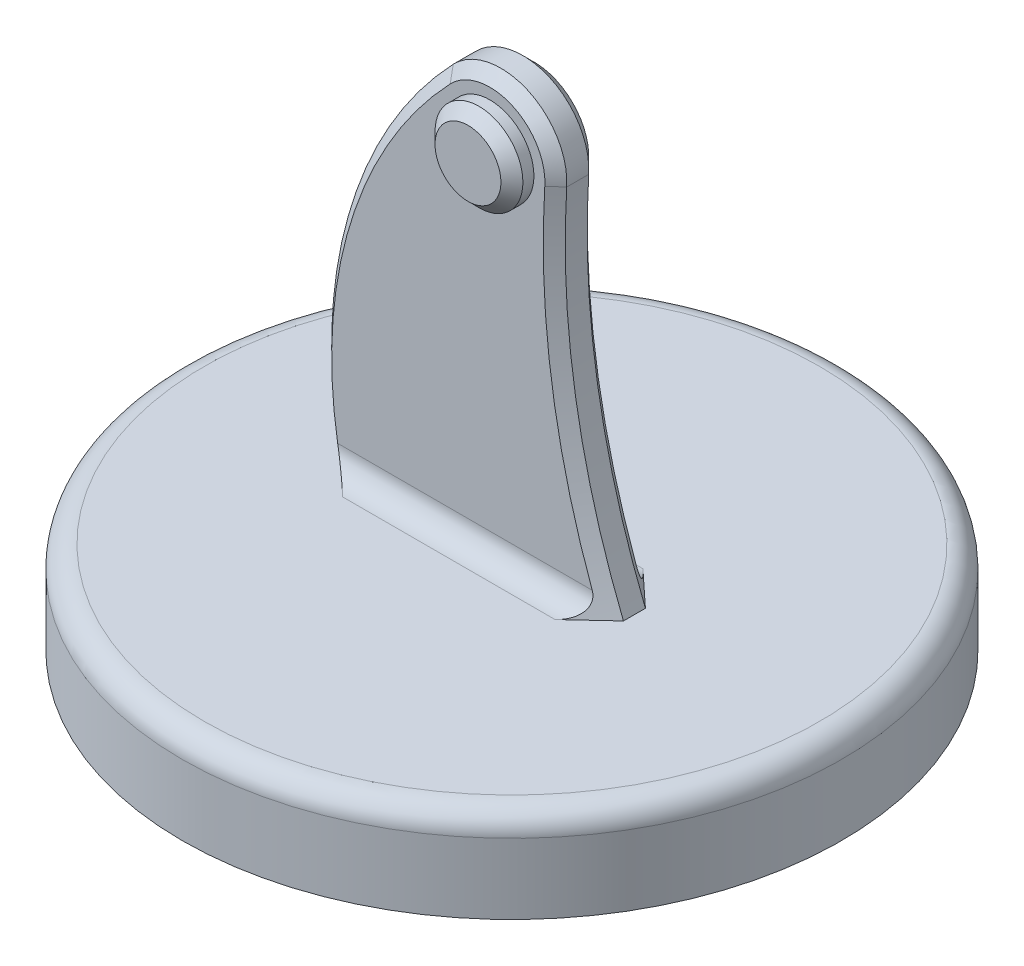
from build123d import *

# Parameters (mm, degrees)
BOSS_EXTRUDE1_DEPTH      = 20
BOSS_EXTRUDE1_DEPTH_BACK = 1
SKETCH1_R                = 75
FILLET1_R                = 5
BOSS_EXTRUDE2_DEPTH      = 5
CHAMFER1_SIZE            = 2.5
FILLET2_R                = 5
SKETCH4_R                = 10
BOSS_EXTRUDE3_DEPTH      = 5
CHAMFER2_SIZE            = 2.5
SKETCH5_R                = 5
CUT_EXTRUDE1_DEPTH       = 10


with BuildPart() as part:
    # Sketch1 → Boss-Extrude1 (new, two sides: drawn at the far end of the back side and taken through both)
    with BuildSketch(Plane(origin=(0, 0, 0), x_dir=(1, 0, 0), z_dir=(0, 1, 0)).offset(-BOSS_EXTRUDE1_DEPTH_BACK)):
        with Locations(Location((0, 0, 0), (0, 0, 270))):
            Circle(SKETCH1_R)
    extrude(amount=BOSS_EXTRUDE1_DEPTH + BOSS_EXTRUDE1_DEPTH_BACK)

    # Fillet1
    fillet1_edges = [part.edges().sort_by_distance(p)[0] for p in [
        (0, 20, -75),
    ]]
    fillet(fillet1_edges, radius=FILLET1_R)

    # Sketch3 → Boss-Extrude2 (add, symmetric)
    with BuildSketch(Plane.XY):
        with BuildLine():
            Line((-35, 15), (30, 15))
            ThreePointArc((30, 15), (17.428098582, 56.126843631), (14.970645506, 99.06203778))
            ThreePointArc((14.970645506, 99.06203778), (6.012327577, 113.742340307), (-10.849201429, 110.358321696))
            ThreePointArc((-10.849201429, 110.358321696), (-35.460543036, 65.854059614), (-35, 15))
        make_face()
    extrude(amount=BOSS_EXTRUDE2_DEPTH, both=True)

    # Chamfer1
    chamfer1_edges = [part.edges().sort_by_distance(p)[0] for p in [
        (-34.796467261, 68.341174934, -5),
        (16.970295051, 58.803839559, -5),
        (6.012327577, 113.742340307, -5),
        (16.970295051, 58.803839559, 5),
        (6.012327577, 113.742340307, 5),
        (-34.796467261, 68.341174934, 5),
    ]]
    chamfer(chamfer1_edges, length=CHAMFER1_SIZE)

    # Fillet2
    fillet2_edges = [part.edges().sort_by_distance(p)[0] for p in [
        (-4.241511046, 20, -5),
        (-4.241511046, 20, 5),
    ]]
    fillet(fillet2_edges, radius=FILLET2_R)

    # Sketch4 → Boss-Extrude3 (add)
    with BuildSketch(Plane.XY.offset(5)):
        with Locations(Location((0, 100, 0), (0, 0, 180))):
            Circle(SKETCH4_R)
    extrude(amount=BOSS_EXTRUDE3_DEPTH)

    # Chamfer2
    chamfer2_edges = [part.edges().sort_by_distance(p)[0] for p in [
        (10, 100, 10),
    ]]
    chamfer(chamfer2_edges, length=CHAMFER2_SIZE)

    # Sketch5 → Cut-Extrude1 (cut)
    with BuildSketch(Plane(origin=(0, 0, -5), x_dir=(-1, 0, 0), z_dir=(0, 0, -1))):
        with Locations((0, 100)):
            Circle(SKETCH5_R)
    extrude(amount=-CUT_EXTRUDE1_DEPTH, mode=Mode.SUBTRACT)


solid = part.part
